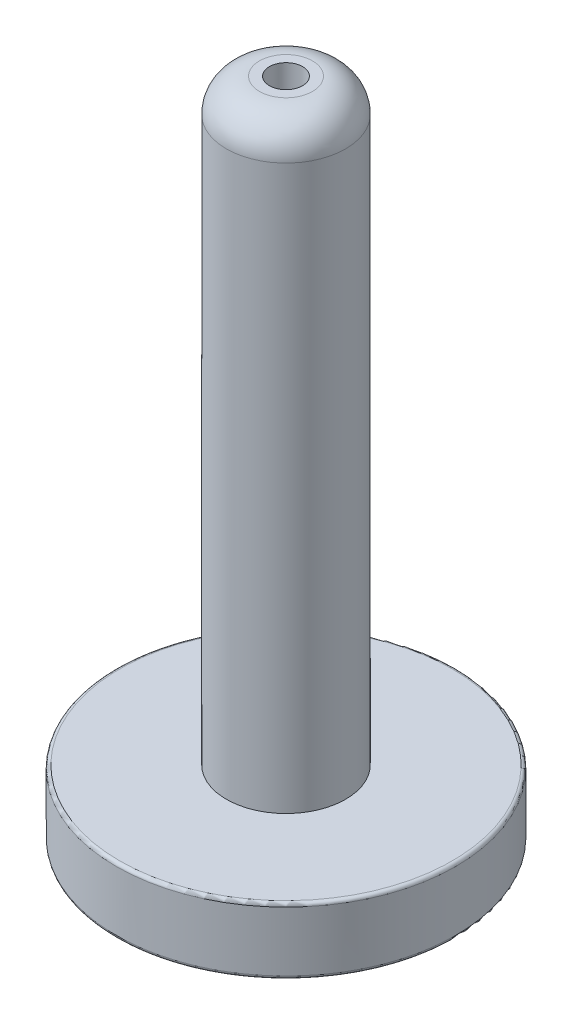
from build123d import *

# Parameters (mm, degrees)
FILLET1_R = 6.35
FILLET2_R = 0.635
FILLET3_R = 2.54


with BuildPart() as part:
    # Sketch3 → Revolve1 (revolve)
    with BuildSketch(Plane.XY, mode=Mode.PRIVATE) as revolve1_sk:
        Polygon((3.175, 127), (3.175, 10.998522628), (9.525, 0), (32.500000024, 0), (32.500000024, 12.7), (11.43, 12.7), (11.43, 127), align=None)
    revolve(revolve1_sk.sketch.rotate(Axis((0, 0, 0), (0, 1, 0)), 90), axis=Axis((0, 0, 0), (0, 1, 0)))

    # Fillet1
    fillet1_edges = [part.edges().sort_by_distance(p)[0] for p in [
        (0, 127, 11.43),
    ]]
    fillet(fillet1_edges, radius=FILLET1_R)

    # Fillet2
    fillet2_edges = [part.edges().sort_by_distance(p)[0] for p in [
        (0, 12.7, 32.500000024),
        (0, 0, 32.500000024),
    ]]
    fillet(fillet2_edges, radius=FILLET2_R)

    # Fillet3
    fillet3_edges = [part.edges().sort_by_distance(p)[0] for p in [
        (0, 10.998522628, 3.175),
    ]]
    fillet(fillet3_edges, radius=FILLET3_R)


solid = part.part
